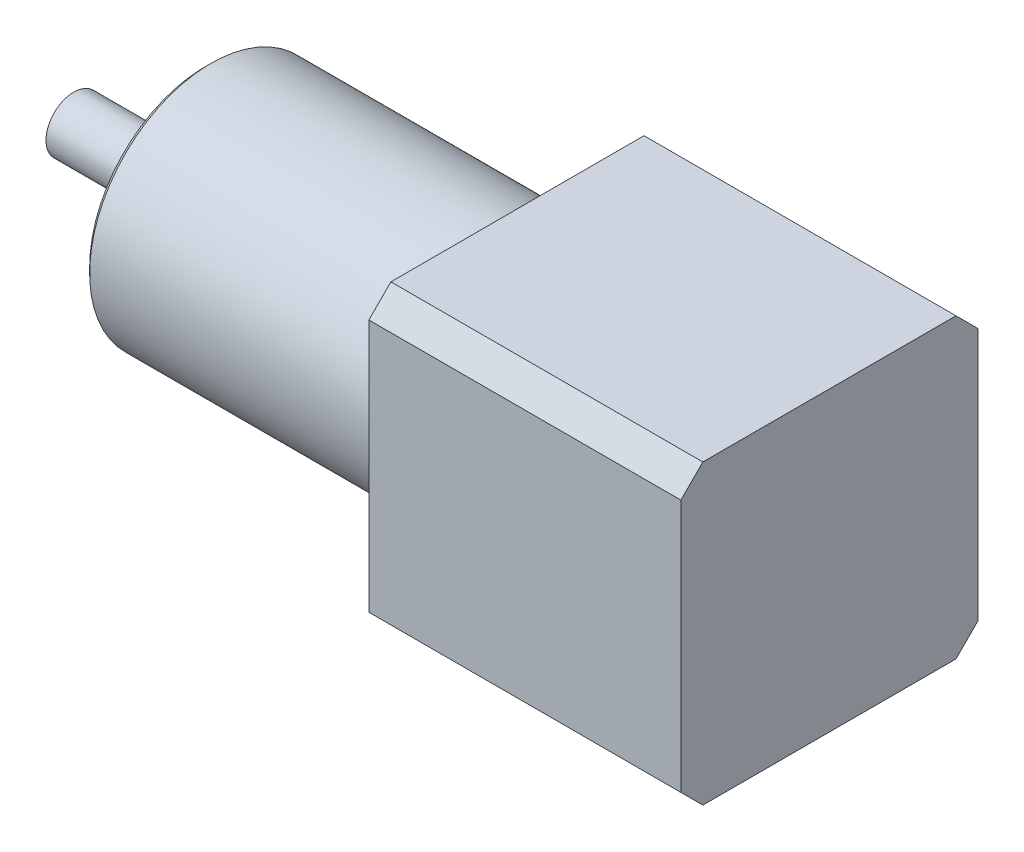
from build123d import *

# Parameters (mm, degrees)
SKETCH1_W           = 42.8625
SKETCH1_H           = 42.8625
BOSS_EXTRUDE1_DEPTH = 45
SKETCH4_R           = 17.5
BOSS_EXTRUDE2_DEPTH = 45
SKETCH5_R           = 4
BOSS_EXTRUDE3_DEPTH = 19
CHAMFER1_SIZE       = 3.175
CHAMFER2_SIZE       = 0.79375


with BuildPart() as part:
    # Sketch1 → Boss-Extrude1 (new body)
    with BuildSketch(Plane(origin=(0, 0, 0), x_dir=(0, 0, -1), z_dir=(1, 0, 0))):
        Rectangle(SKETCH1_W, SKETCH1_H)
    extrude(amount=-BOSS_EXTRUDE1_DEPTH)

    # Sketch4 → Boss-Extrude2 (add)
    with BuildSketch(Plane.ZY.offset(45)):
        with Locations(Location((0, 0, 0), (0, 0, 180))):
            Circle(SKETCH4_R)
    extrude(amount=BOSS_EXTRUDE2_DEPTH)

    # Sketch5 → Boss-Extrude3 (add)
    with BuildSketch(Plane.ZY.offset(90)):
        Circle(SKETCH5_R)
    extrude(amount=BOSS_EXTRUDE3_DEPTH)

    # Chamfer1
    chamfer1_edges = [part.edges().sort_by_distance(p)[0] for p in [
        (-22.5, -21.43125, -21.43125),
        (-22.5, -21.43125, 21.43125),
        (-22.5, 21.43125, 21.43125),
        (-22.5, 21.43125, -21.43125),
    ]]
    chamfer(chamfer1_edges, length=CHAMFER1_SIZE)

    # Chamfer2
    chamfer2_edges = [part.edges().sort_by_distance(p)[0] for p in [
        (-90, 0, 17.5),
    ]]
    chamfer(chamfer2_edges, length=CHAMFER2_SIZE)


solid = part.part
